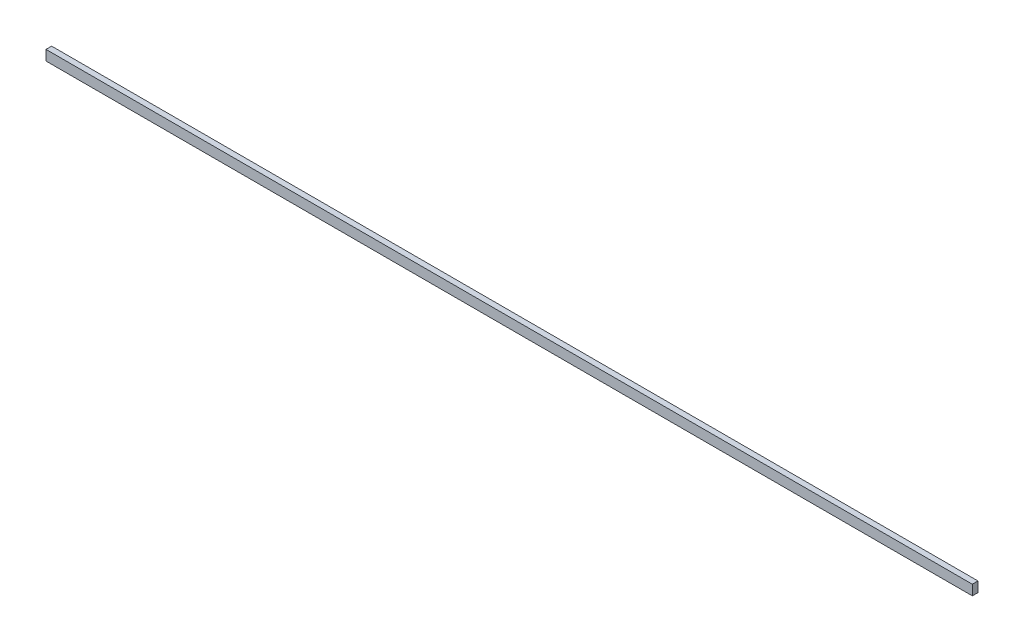
from build123d import *

# Parameters (mm, degrees)
SKETCH_2_W      = 458.4
SKETCH_2_H      = 5
EXTRUDE_1_DEPTH = 1.4


with BuildPart() as part:
    # Эскиз2 → Бобышка-Вытянуть1 (new, symmetric)
    with BuildSketch(Plane.XY):
        Rectangle(SKETCH_2_W, SKETCH_2_H)
    extrude(amount=EXTRUDE_1_DEPTH, both=True)


solid = part.part
